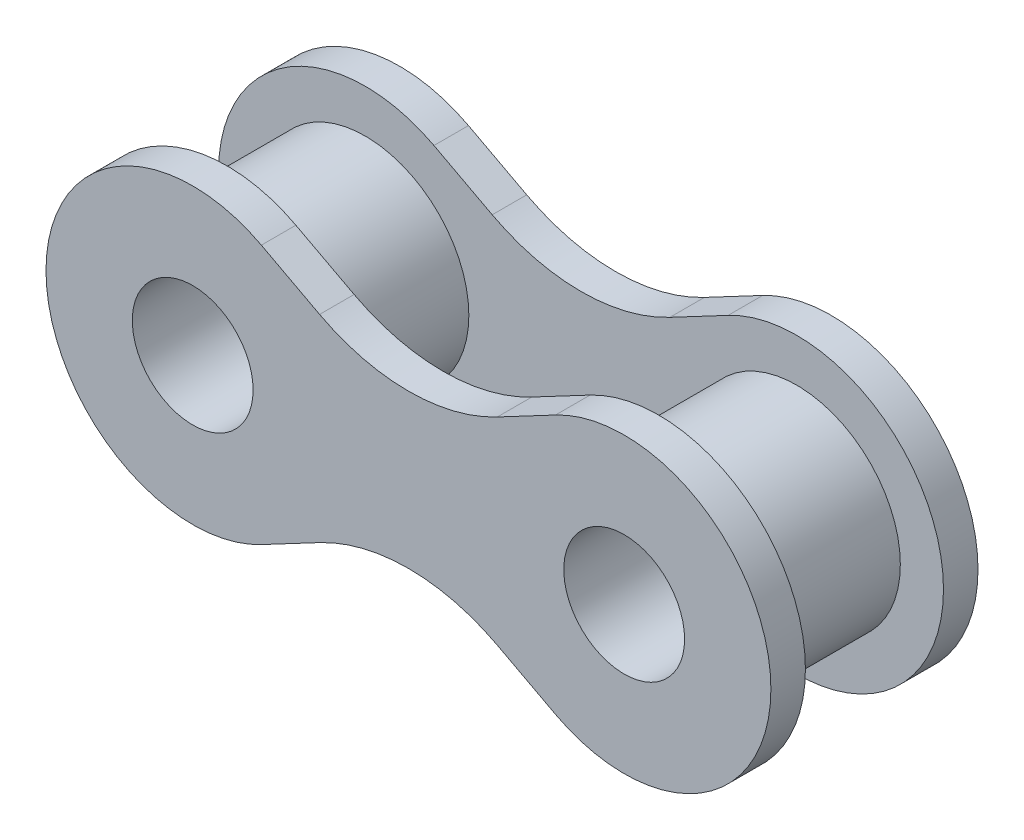
from build123d import *

# Parameters (mm, degrees)
SKETCH1_R           = 1.75
BOSS_EXTRUDE1_DEPTH = 0.5
SKETCH2_R           = 1.75
BOSS_EXTRUDE2_DEPTH = 1
BOSS_EXTRUDE3_START = -6
SKETCH3_R           = 3
SKETCH3_R_2         = 1.75
BOSS_EXTRUDE3_DEPTH = 6


with BuildPart() as part:
    # Sketch1 → Boss-Extrude1 (new, symmetric)
    with BuildSketch(Plane.XY):
        with BuildLine():
            Line((-4.261461708, 3.756090449), (-2.573402496, 2.862403135))
            ThreePointArc((-2.573402496, 2.862403135), (0, 2.223226069), (2.573402496, 2.862403135))
            Line((2.573402496, 2.862403135), (4.261461708, 3.756090449))
            ThreePointArc((4.261461708, 3.756090449), (10.5, 0), (4.261461708, -3.756090449))
            Line((4.261461708, -3.756090449), (2.573402496, -2.862403135))
            ThreePointArc((2.573402496, -2.862403135), (0, -2.223226069), (-2.573402496, -2.862403135))
            Line((-2.573402496, -2.862403135), (-4.261461708, -3.756090449))
            ThreePointArc((-4.261461708, -3.756090449), (-10.5, 0), (-4.261461708, 3.756090449))
        make_face()
        with Locations((-6.25, 0)):
            Circle(SKETCH1_R, mode=Mode.SUBTRACT)
        with Locations((6.25, 0)):
            Circle(SKETCH1_R, mode=Mode.SUBTRACT)
    extrude(amount=BOSS_EXTRUDE1_DEPTH, both=True)



with BuildPart() as body_2:
    # Sketch2 → Boss-Extrude2 (new body)
    with BuildSketch(Plane.XY.offset(5.5)):
        with BuildLine():
            Line((-2.573402496, 2.862403135), (-4.261461708, 3.756090449))
            ThreePointArc((-4.261461708, 3.756090449), (-10.5, 0), (-4.261461708, -3.756090449))
            Line((-4.261461708, -3.756090449), (-2.573402496, -2.862403135))
            ThreePointArc((-2.573402496, -2.862403135), (0, -2.223226069), (2.573402496, -2.862403135))
            Line((2.573402496, -2.862403135), (4.261461708, -3.756090449))
            ThreePointArc((4.261461708, -3.756090449), (10.5, 0), (4.261461708, 3.756090449))
            Line((4.261461708, 3.756090449), (2.573402496, 2.862403135))
            ThreePointArc((2.573402496, 2.862403135), (0, 2.223226069), (-2.573402496, 2.862403135))
        make_face()
        with Locations((6.25, 0)):
            Circle(SKETCH2_R, mode=Mode.SUBTRACT)
        with Locations((-6.25, 0)):
            Circle(SKETCH2_R, mode=Mode.SUBTRACT)
    extrude(amount=-BOSS_EXTRUDE2_DEPTH)


with BuildPart() as part_1:
    add(part.part)

    add(body_2.part)  # Boss-Extrude3 merges body 2
    # Sketch3 → Boss-Extrude3 (add)
    # profile 1 of 2: a face of its own
    with BuildSketch(Plane.XY.offset(5.5).offset(BOSS_EXTRUDE3_START)):
        with Locations((-6.25, 0)):
            Circle(SKETCH3_R)
        with Locations((-6.25, 0)):
            Circle(SKETCH3_R_2, mode=Mode.SUBTRACT)
    # profile 2 of 2: a face of its own
    with BuildSketch(Plane.XY.offset(5.5).offset(BOSS_EXTRUDE3_START)):
        with Locations((6.25, 0)):
            Circle(SKETCH3_R)
        with Locations((6.25, 0)):
            Circle(SKETCH3_R_2, mode=Mode.SUBTRACT)
    extrude(amount=BOSS_EXTRUDE3_DEPTH)


solid = part_1.part
